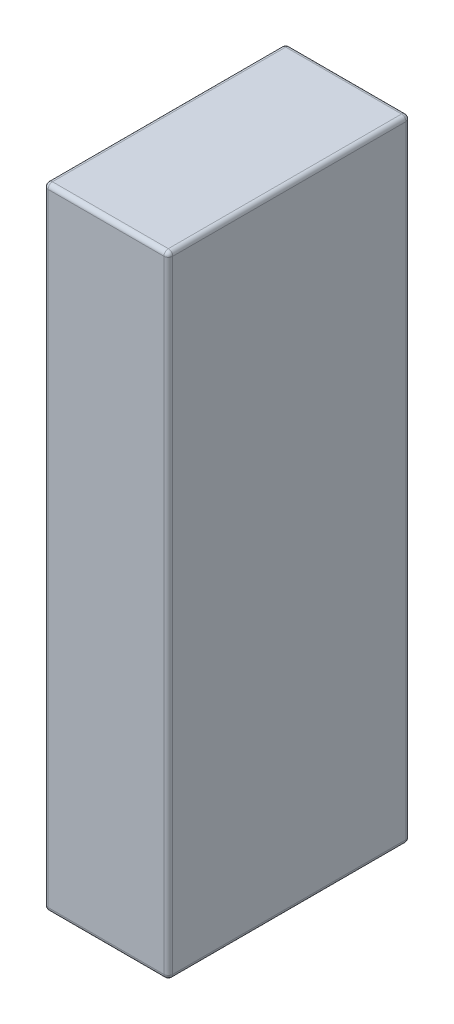
from build123d import *

# Parameters (mm, degrees)
CROQUIS1_W              = 85
CROQUIS1_H              = 430
SALIENTE_EXTRUIR1_DEPTH = 165
REDONDEO1_R             = 3


with BuildPart() as part:
    # Croquis1 → Saliente-Extruir1 (new body)
    with BuildSketch(Plane.XY):
        with Locations((-61.006965944, -46.647058824)):
            Rectangle(CROQUIS1_W, CROQUIS1_H)
    extrude(amount=SALIENTE_EXTRUIR1_DEPTH)

    # Redondeo1
    redondeo1_edges = [part.edges().sort_by_distance(p)[0] for p in [
        (-18.506965944, -46.647058824, 165),
        (-61.006965944, 168.352941176, 165),
        (-103.506965944, -46.647058824, 165),
        (-61.006965944, 168.352941176, 0),
        (-18.506965944, -46.647058824, 0),
        (-61.006965944, -261.647058824, 0),
        (-103.506965944, -46.647058824, 0),
        (-61.006965944, -261.647058824, 165),
        (-103.506965944, 168.352941176, 82.5),
        (-18.506965944, 168.352941176, 82.5),
        (-18.506965944, -261.647058824, 82.5),
        (-103.506965944, -261.647058824, 82.5),
    ]]
    fillet(redondeo1_edges, radius=REDONDEO1_R)


solid = part.part
